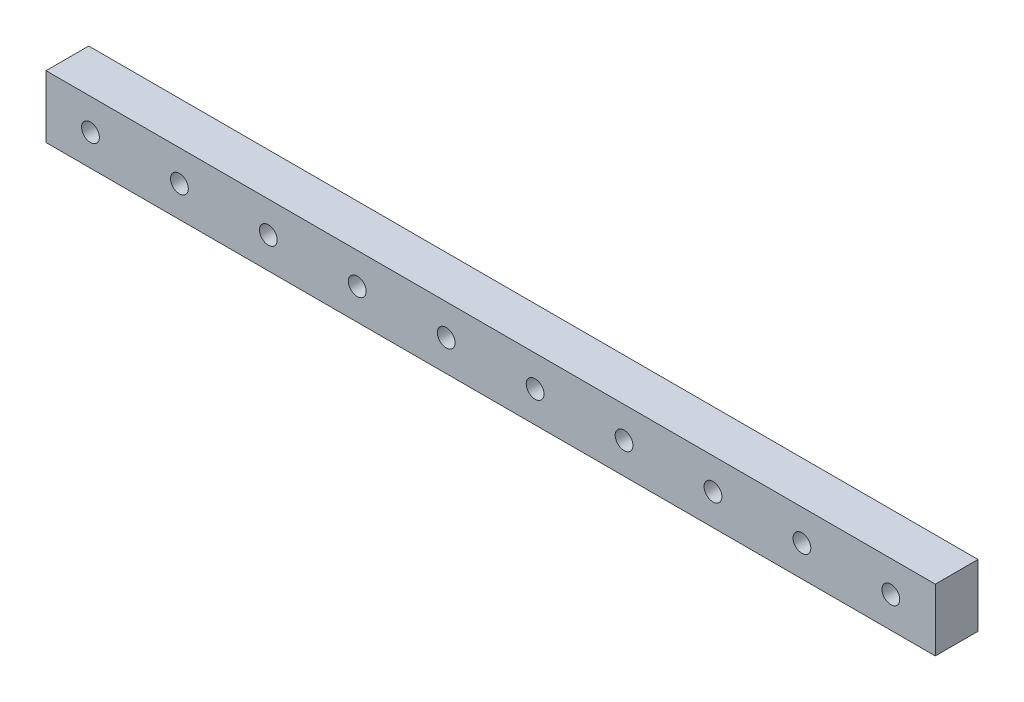
from build123d import *

# Parameters (mm, degrees)
SKETCH_1_W          = 100
SKETCH_1_H          = 7
EXTRUDE_1_DEPTH     = 4.8
SKETCH_2_R          = 1
CUT_EXTRUDE_1_DEPTH = 4.8


with BuildPart() as part:
    # 草图1 → 凸台-拉伸1 (new body)
    with BuildSketch(Plane.XY):
        with Locations((50, 3.5)):
            Rectangle(SKETCH_1_W, SKETCH_1_H)
    extrude(amount=EXTRUDE_1_DEPTH)

    # 草图2 → 切除-拉伸1 (cut)
    with BuildSketch(Plane.XY.offset(4.8)):
        with BuildLine():
            ThreePointArc((6, 3.5), (5, 4.5), (4, 3.5))
            Line((4, 3.5), (6, 3.5))
        make_face()
        with BuildLine():
            Line((6, 3.5), (4, 3.5))
            ThreePointArc((4, 3.5), (5, 2.5), (6, 3.5))
        make_face()
        with BuildLine():
            ThreePointArc((16, 3.5), (15, 4.5), (14, 3.5))
            Line((14, 3.5), (16, 3.5))
        make_face()
        with BuildLine():
            Line((16, 3.5), (14, 3.5))
            ThreePointArc((14, 3.5), (15, 2.5), (16, 3.5))
        make_face()
        with BuildLine():
            ThreePointArc((26, 3.5), (25, 4.5), (24, 3.5))
            Line((24, 3.5), (26, 3.5))
        make_face()
        with BuildLine():
            Line((26, 3.5), (24, 3.5))
            ThreePointArc((24, 3.5), (25, 2.5), (26, 3.5))
        make_face()
        with BuildLine():
            ThreePointArc((36, 3.5), (35, 4.5), (34, 3.5))
            Line((34, 3.5), (36, 3.5))
        make_face()
        with BuildLine():
            Line((36, 3.5), (34, 3.5))
            ThreePointArc((34, 3.5), (35, 2.5), (36, 3.5))
        make_face()
        with BuildLine():
            ThreePointArc((46, 3.5), (45, 4.5), (44, 3.5))
            Line((44, 3.5), (46, 3.5))
        make_face()
        with BuildLine():
            Line((46, 3.5), (44, 3.5))
            ThreePointArc((44, 3.5), (45, 2.5), (46, 3.5))
        make_face()
        with BuildLine():
            ThreePointArc((56, 3.5), (55, 4.5), (54, 3.5))
            Line((54, 3.5), (56, 3.5))
        make_face()
        with BuildLine():
            Line((56, 3.5), (54, 3.5))
            ThreePointArc((54, 3.5), (55, 2.5), (56, 3.5))
        make_face()
        with BuildLine():
            ThreePointArc((76, 3.5), (75, 4.5), (74, 3.5))
            Line((74, 3.5), (76, 3.5))
        make_face()
        with BuildLine():
            Line((76, 3.5), (74, 3.5))
            ThreePointArc((74, 3.5), (75, 2.5), (76, 3.5))
        make_face()
        with BuildLine():
            ThreePointArc((86, 3.5), (85, 4.5), (84, 3.5))
            Line((84, 3.5), (86, 3.5))
        make_face()
        with BuildLine():
            Line((86, 3.5), (84, 3.5))
            ThreePointArc((84, 3.5), (85, 2.5), (86, 3.5))
        make_face()
        with BuildLine():
            ThreePointArc((96, 3.5), (95, 4.5), (94, 3.5))
            Line((94, 3.5), (96, 3.5))
        make_face()
        with BuildLine():
            Line((96, 3.5), (94, 3.5))
            ThreePointArc((94, 3.5), (95, 2.5), (96, 3.5))
        make_face()
        with Locations((65, 3.5)):
            Circle(SKETCH_2_R)
    extrude(amount=-CUT_EXTRUDE_1_DEPTH, mode=Mode.SUBTRACT)


solid = part.part
